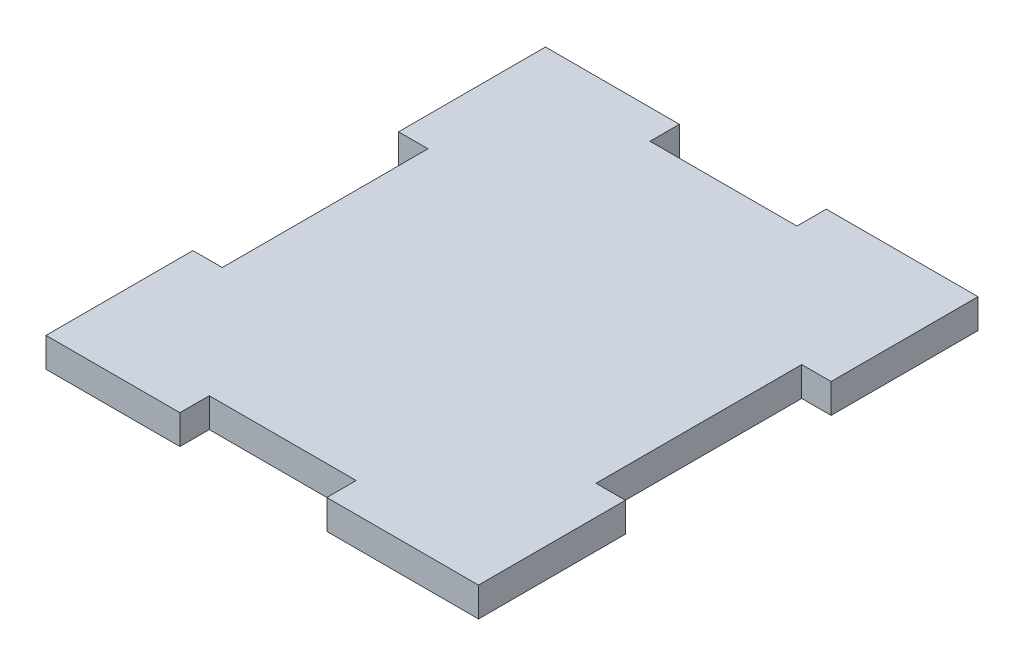
from build123d import *

# Parameters (mm, degrees)
SKETCH1_W           = 76.32
SKETCH1_H           = 102
BOSS_EXTRUDE1_DEPTH = 6
SKETCH2_W           = 30
SKETCH2_H           = 6
BOSS_EXTRUDE2_DEPTH = 6
LPATTERN1_COUNT     = 2
LPATTERN1_PITCH     = 72
SKETCH4_W           = 30
SKETCH4_H           = 6
BOSS_EXTRUDE3_DEPTH = 6
LPATTERN2_COUNT     = 2
LPATTERN2_PITCH     = 72
SKETCH5_W           = 30
SKETCH5_H           = 6
CUT_EXTRUDE1_DEPTH  = 6


with BuildPart() as part:
    # Sketch1 → Boss-Extrude1 (new body)
    with BuildSketch(Plane(origin=(0, 0, 0), x_dir=(1, 0, 0), z_dir=(0, 1, 0))):
        with Locations((38.16, 51)):
            Rectangle(SKETCH1_W, SKETCH1_H)
    extrude(amount=BOSS_EXTRUDE1_DEPTH)

    # Sketch2 → Boss-Extrude2 (add)
    with BuildSketch(Plane(origin=(76.32, 0, 0), x_dir=(0, 0, -1), z_dir=(1, 0, 0))):
        with Locations((15, 3)):
            Rectangle(SKETCH2_W, SKETCH2_H)
    boss_extrude2 = extrude(amount=BOSS_EXTRUDE2_DEPTH)

    # LPattern1: Boss-Extrude2 ×2
    with Locations(*[(0, 0, -i * LPATTERN1_PITCH) for i in range(1, LPATTERN1_COUNT)]):
        add(boss_extrude2)

    # Sketch4 → Boss-Extrude3 (add)
    with BuildSketch(Plane.ZY):
        with Locations((-87, 3)):
            Rectangle(SKETCH4_W, SKETCH4_H)
    boss_extrude3 = extrude(amount=BOSS_EXTRUDE3_DEPTH)

    # LPattern2: Boss-Extrude3 ×2
    with Locations(*[(0, 0, i * LPATTERN2_PITCH) for i in range(1, LPATTERN2_COUNT)]):
        add(boss_extrude3)

    # Sketch5 → Cut-Extrude1 (cut)
    with BuildSketch(Plane.XY):
        with Locations((36.34, 3)):
            Rectangle(SKETCH5_W, SKETCH5_H)
    cut_extrude1 = extrude(amount=-CUT_EXTRUDE1_DEPTH, mode=Mode.SUBTRACT)

    # Mirror1: Cut-Extrude1 across plane
    add(cut_extrude1.mirror(Plane(origin=(0, 0, -51), x_dir=(1, 0, 0), z_dir=(0, 0, -1))), mode=Mode.SUBTRACT)


solid = part.part
